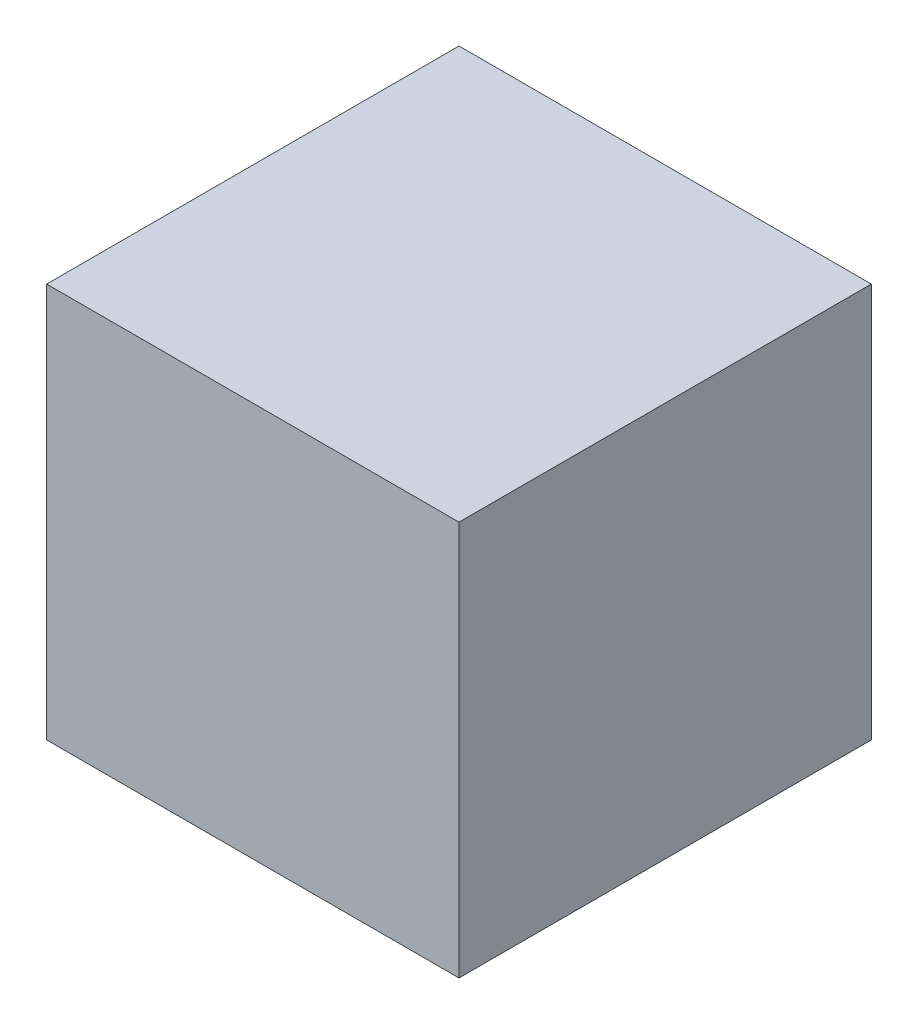
from build123d import *

# Parameters (mm, degrees)
SKETCH_1_W      = 94
SKETCH_1_H      = 94
EXTRUDE_1_DEPTH = 90


with BuildPart() as part:
    # 草图1 → 凸台-拉伸1 (new body)
    with BuildSketch(Plane(origin=(0, 0, 0), x_dir=(1, 0, 0), z_dir=(0, 1, 0))):
        Rectangle(SKETCH_1_W, SKETCH_1_H)
    extrude(amount=EXTRUDE_1_DEPTH)


solid = part.part
